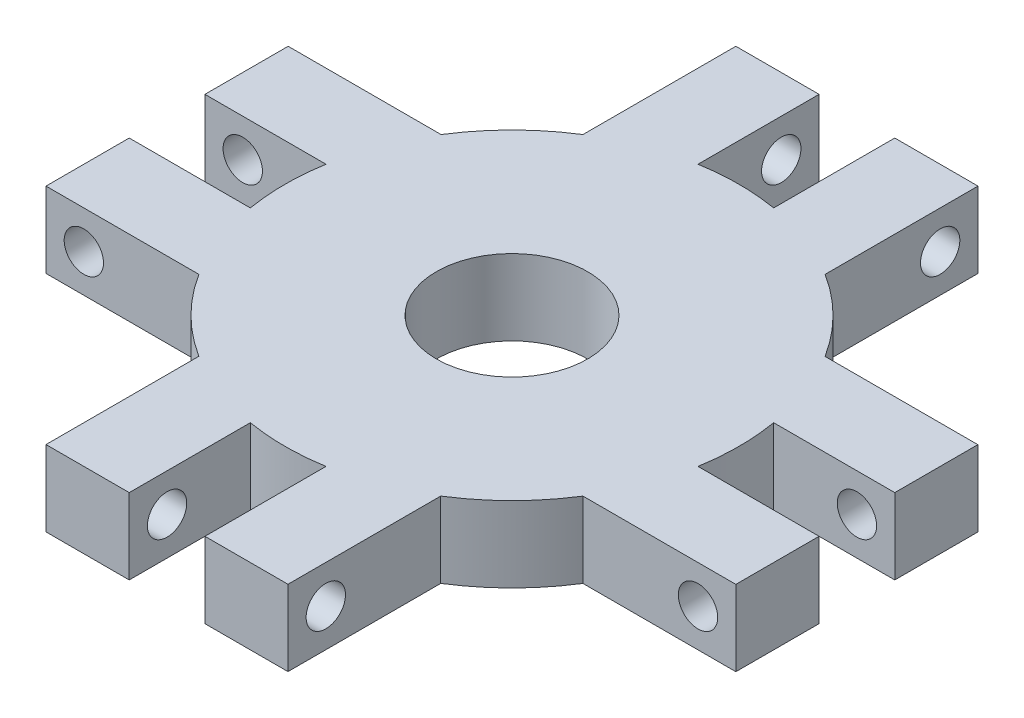
from build123d import *

# Parameters (mm, degrees)
BOSS_EXTRUDE1_DEPTH = 6.35
SKETCH2_R           = 1.651
CUT_EXTRUDE1_DEPTH  = 23.368
SKETCH3_R           = 1.651
CUT_EXTRUDE2_DEPTH  = 23.368
SKETCH4_R           = 1.651
CUT_EXTRUDE3_DEPTH  = 23.368
SKETCH5_R           = 1.651
CUT_EXTRUDE4_DEPTH  = 23.368
SKETCH6_R           = 6.35
CUT_EXTRUDE5_DEPTH  = 14.3002


with BuildPart() as part:
    # Sketch1 → Boss-Extrude1 (new body)
    with BuildSketch(Plane(origin=(0, 0, 0), x_dir=(1, 0, 0), z_dir=(0, 1, 0))):
        with BuildLine():
            Line((-3.175, 18.783553311), (-3.175, 28.943553311))
            Line((-3.175, 28.943553311), (-10.16, 28.943553311))
            Line((-10.16, 28.943553311), (-10.16, 16.114493476))
            ThreePointArc((-10.16, 16.114493476), (-13.470384182, 13.470384182), (-16.114493476, 10.16))
            Line((-16.114493476, 10.16), (-28.943553311, 10.16))
            Line((-28.943553311, 10.16), (-28.943553311, 3.175))
            Line((-28.943553311, 3.175), (-18.783553311, 3.175))
            ThreePointArc((-18.783553311, 3.175), (-19.05, 0), (-18.783553311, -3.175))
            Line((-18.783553311, -3.175), (-28.943553311, -3.175))
            Line((-28.943553311, -3.175), (-28.943553311, -10.16))
            Line((-28.943553311, -10.16), (-16.114493476, -10.16))
            ThreePointArc((-16.114493476, -10.16), (-13.470384182, -13.470384182), (-10.16, -16.114493476))
            Line((-10.16, -16.114493476), (-10.16, -28.943553311))
            Line((-10.16, -28.943553311), (-3.175, -28.943553311))
            Line((-3.175, -28.943553311), (-3.175, -18.783553311))
            ThreePointArc((-3.175, -18.783553311), (0, -19.05), (3.175, -18.783553311))
            Line((3.175, -18.783553311), (3.175, -28.943553311))
            Line((3.175, -28.943553311), (10.144252899, -28.943553311))
            Line((10.144252899, -28.943553311), (10.144252899, -16.124411094))
            ThreePointArc((10.144252899, -16.124411094), (13.463802963, -13.476962186), (16.114493476, -10.16))
            Line((16.114493476, -10.16), (28.943553311, -10.16))
            Line((28.943553311, -10.16), (28.943553311, -3.175))
            Line((28.943553311, -3.175), (18.783553311, -3.175))
            ThreePointArc((18.783553311, -3.175), (19.05, 0), (18.783553311, 3.175))
            Line((18.783553311, 3.175), (28.943553311, 3.175))
            Line((28.943553311, 3.175), (28.943553311, 10.146623982))
            Line((28.943553311, 10.146623982), (16.122919145, 10.146623982))
            ThreePointArc((16.122919145, 10.146623982), (13.475972183, 13.464793861), (10.16, 16.114493476))
            Line((10.16, 16.114493476), (10.16, 28.943553311))
            Line((10.16, 28.943553311), (3.175, 28.943553311))
            Line((3.175, 28.943553311), (3.175, 18.783553311))
            ThreePointArc((3.175, 18.783553311), (0, 19.05), (-3.175, 18.783553311))
        make_face()
    extrude(amount=BOSS_EXTRUDE1_DEPTH)

    # Sketch2 → Cut-Extrude1 (cut)
    with BuildSketch(Plane(origin=(10.16, 0, 0), x_dir=(0, 0, -1), z_dir=(1, 0, 0))):
        with Locations((25.768553311, 3.175)):
            Circle(SKETCH2_R)
    extrude(amount=-CUT_EXTRUDE1_DEPTH, mode=Mode.SUBTRACT)

    # Sketch3 → Cut-Extrude2 (cut)
    with BuildSketch(Plane(origin=(0, 0, -10.146623982), x_dir=(-1, 0, 0), z_dir=(0, 0, -1))):
        with Locations((-25.768553311, 3.175)):
            Circle(SKETCH3_R)
    extrude(amount=-CUT_EXTRUDE2_DEPTH, mode=Mode.SUBTRACT)

    # Sketch4 → Cut-Extrude3 (cut)
    with BuildSketch(Plane(origin=(10.144252899, 0, 0), x_dir=(0, 0, -1), z_dir=(1, 0, 0))):
        with Locations((-25.768553311, 3.175)):
            Circle(SKETCH4_R)
    extrude(amount=-CUT_EXTRUDE3_DEPTH, mode=Mode.SUBTRACT)

    # Sketch5 → Cut-Extrude4 (cut)
    with BuildSketch(Plane.XY.offset(10.16)):
        with Locations((-25.768553311, 3.175)):
            Circle(SKETCH5_R)
    extrude(amount=-CUT_EXTRUDE4_DEPTH, mode=Mode.SUBTRACT)

    # Sketch6 → Cut-Extrude5 (cut)
    with BuildSketch(Plane(origin=(0, 6.35, 0), x_dir=(1, 0, 0), z_dir=(0, 1, 0))):
        with Locations(Location((0, 0, 0), (0, 0, 270))):
            Circle(SKETCH6_R)
    extrude(amount=-CUT_EXTRUDE5_DEPTH, mode=Mode.SUBTRACT)


solid = part.part
